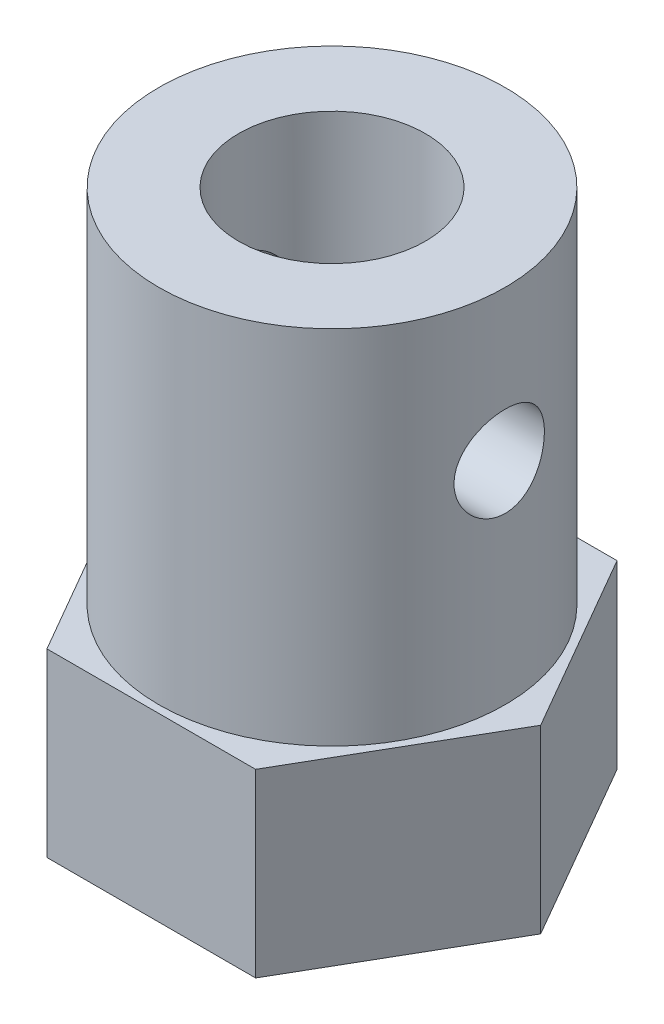
from build123d import *

# Parameters (mm, degrees)
SKETCH1_R           = 1.5
BOSS_EXTRUDE1_DEPTH = 6
SKETCH2_R           = 5.75
SKETCH2_R_2         = 3.1
BOSS_EXTRUDE2_DEPTH = 12
SKETCH3_R           = 1.5
CUT_EXTRUDE1_DEPTH  = 6


with BuildPart() as part:
    # Sketch1 → Boss-Extrude1 (new body)
    with BuildSketch(Plane(origin=(0, 0, 0), x_dir=(1, 0, 0), z_dir=(0, 1, 0))):
        Polygon((6.92820323, 0), (3.464101615, 6), (-3.464101615, 6), (-6.92820323, 0), (-3.464101615, -6), (3.464101615, -6), align=None)
        with Locations(Location((0, 0, 0), (0, 0, 270))):
            Circle(SKETCH1_R, mode=Mode.SUBTRACT)
    extrude(amount=BOSS_EXTRUDE1_DEPTH)

    # Sketch2 → Boss-Extrude2 (add)
    with BuildSketch(Plane(origin=(0, 6, 0), x_dir=(1, 0, 0), z_dir=(0, 1, 0))):
        with Locations(Location((0, 0, 0), (0, 0, 270))):
            Circle(SKETCH2_R)
        with Locations(Location((0, 0, 0), (0, 0, 270))):
            Circle(SKETCH2_R_2, mode=Mode.SUBTRACT)
    extrude(amount=BOSS_EXTRUDE2_DEPTH)

    # Sketch3 → Cut-Extrude1 (cut, symmetric)
    with BuildSketch(Plane(origin=(0, 0, 0), x_dir=(0, 0, -1), z_dir=(1, 0, 0))):
        with Locations((0, 13)):
            Circle(SKETCH3_R)
    extrude(amount=CUT_EXTRUDE1_DEPTH, both=True, mode=Mode.SUBTRACT)


solid = part.part
